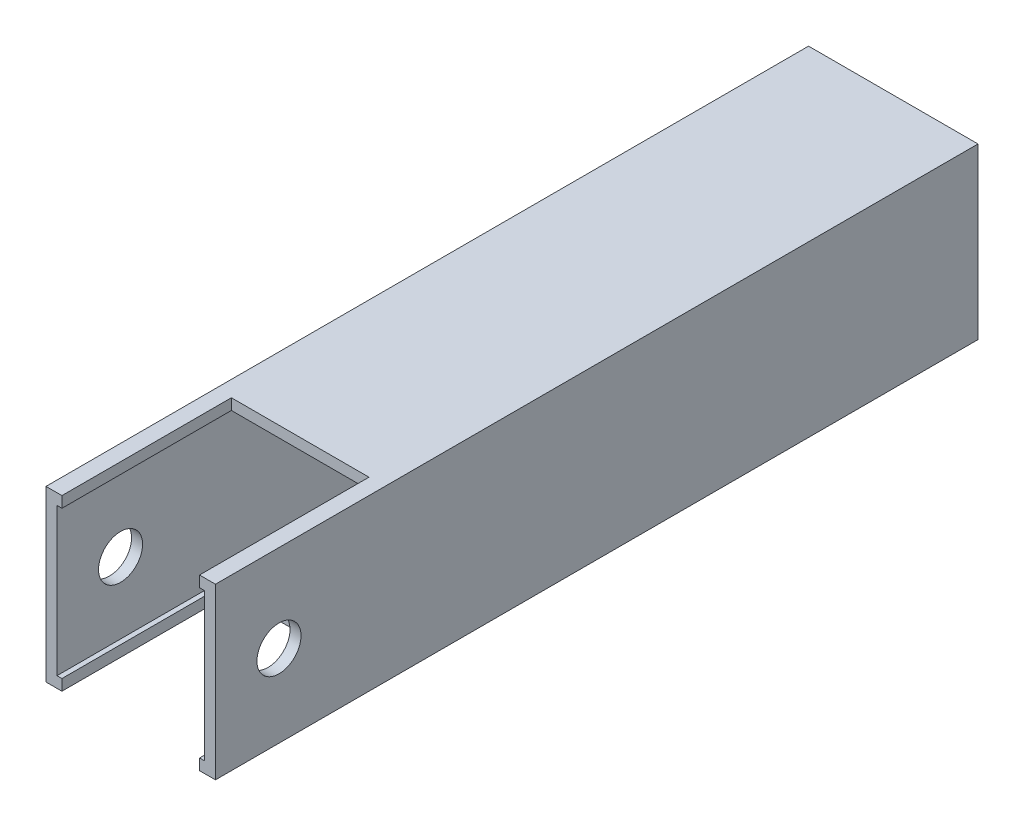
from build123d import *

# Parameters (mm, degrees)
SKETCH1_W           = 25.4
SKETCH1_H           = 25.4
BOSS_EXTRUDE1_DEPTH = 114.3
SKETCH3_W           = 22.098
SKETCH3_H           = 22.098
CUT_EXTRUDE1_DEPTH  = 130.139939168
SKETCH4_W           = 20.6248
SKETCH4_H           = 50.8
CUT_EXTRUDE2_DEPTH  = 128.825773065
SKETCH5_R           = 3.302
CUT_EXTRUDE3_DEPTH  = 122.212646323


with BuildPart() as part:
    # Sketch1 → Boss-Extrude1 (new body)
    with BuildSketch(Plane.XY):
        with Locations((-38.581363669, -18.650528362)):
            Rectangle(SKETCH1_W, SKETCH1_H)
    extrude(amount=BOSS_EXTRUDE1_DEPTH)

    # Sketch3 → Cut-Extrude1 (cut, through all)
    with BuildSketch(Plane.XY.offset(114.3)):
        with Locations((-38.581363669, -18.650528362)):
            Rectangle(SKETCH3_W, SKETCH3_H)
    extrude(amount=-CUT_EXTRUDE1_DEPTH, mode=Mode.SUBTRACT)

    # Sketch4 → Cut-Extrude2 (cut, through all)
    with BuildSketch(Plane(origin=(0, -5.950528362, 0), x_dir=(1, 0, 0), z_dir=(0, 1, 0))):
        with Locations((-38.581363669, -114.3)):
            Rectangle(SKETCH4_W, SKETCH4_H)
    extrude(amount=-CUT_EXTRUDE2_DEPTH, mode=Mode.SUBTRACT)

    # Sketch5 → Cut-Extrude3 (cut, through all)
    with BuildSketch(Plane.ZY.offset(51.281363669)):
        with Locations((104.775, -19.04458559)):
            Circle(SKETCH5_R)
    extrude(amount=-CUT_EXTRUDE3_DEPTH, mode=Mode.SUBTRACT)


solid = part.part
